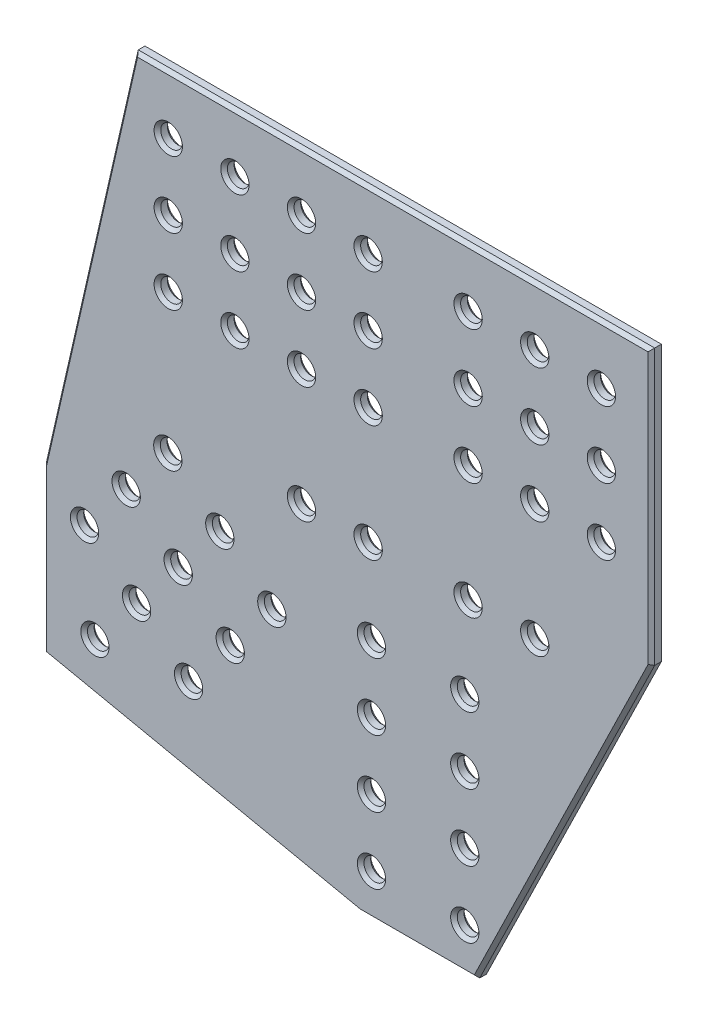
from build123d import *

# Parameters (mm, degrees)
SKETCH_1_R         = 13
EXTRUDE_1495_DEPTH = 16
CHAMFER_2_SIZE     = 4


with BuildPart() as part:
    # 草图1 → Extrude 1495 (new body)
    with BuildSketch(Plane.XY):
        Polygon((730, -330), (520, -760), (380, -760), (0, -680), (0, -482.786642105), (110, 0), (730, 0), align=None)
        with Locations((510, -70)):
            Circle(SKETCH_1_R, mode=Mode.SUBTRACT)
        with Locations((590, -70)):
            Circle(SKETCH_1_R, mode=Mode.SUBTRACT)
        with Locations((670, -70)):
            Circle(SKETCH_1_R, mode=Mode.SUBTRACT)
        with Locations((510, -150)):
            Circle(SKETCH_1_R, mode=Mode.SUBTRACT)
        with Locations((590, -150)):
            Circle(SKETCH_1_R, mode=Mode.SUBTRACT)
        with Locations((670, -150)):
            Circle(SKETCH_1_R, mode=Mode.SUBTRACT)
        with Locations((510, -230)):
            Circle(SKETCH_1_R, mode=Mode.SUBTRACT)
        with Locations((590, -230)):
            Circle(SKETCH_1_R, mode=Mode.SUBTRACT)
        with Locations((670, -230)):
            Circle(SKETCH_1_R, mode=Mode.SUBTRACT)
        with Locations(Location((230, -230, 0), (0, 0, 180))):
            Circle(SKETCH_1_R, mode=Mode.SUBTRACT)
        with Locations(Location((310, -230, 0), (0, 0, 180))):
            Circle(SKETCH_1_R, mode=Mode.SUBTRACT)
        with Locations(Location((390, -230, 0), (0, 0, 180))):
            Circle(SKETCH_1_R, mode=Mode.SUBTRACT)
        with Locations(Location((230, -150, 0), (0, 0, 180))):
            Circle(SKETCH_1_R, mode=Mode.SUBTRACT)
        with Locations(Location((310, -150, 0), (0, 0, 180))):
            Circle(SKETCH_1_R, mode=Mode.SUBTRACT)
        with Locations(Location((390, -150, 0), (0, 0, 180))):
            Circle(SKETCH_1_R, mode=Mode.SUBTRACT)
        with Locations(Location((230, -70, 0), (0, 0, 180))):
            Circle(SKETCH_1_R, mode=Mode.SUBTRACT)
        with Locations(Location((310, -70, 0), (0, 0, 180))):
            Circle(SKETCH_1_R, mode=Mode.SUBTRACT)
        with Locations(Location((390, -70, 0), (0, 0, 180))):
            Circle(SKETCH_1_R, mode=Mode.SUBTRACT)
        with Locations((150, -70)):
            Circle(SKETCH_1_R, mode=Mode.SUBTRACT)
        with Locations((150, -150)):
            Circle(SKETCH_1_R, mode=Mode.SUBTRACT)
        with Locations((150, -230)):
            Circle(SKETCH_1_R, mode=Mode.SUBTRACT)
        with Locations((590, -370)):
            Circle(SKETCH_1_R, mode=Mode.SUBTRACT)
        with Locations((510, -370)):
            Circle(SKETCH_1_R, mode=Mode.SUBTRACT)
        with Locations(Location((390, -370, 0), (0, 0, 180))):
            Circle(SKETCH_1_R, mode=Mode.SUBTRACT)
        with Locations(Location((310, -370, 0), (0, 0, 180))):
            Circle(SKETCH_1_R, mode=Mode.SUBTRACT)
        with Locations((506, -470)):
            Circle(SKETCH_1_R, mode=Mode.SUBTRACT)
        with Locations((506, -550)):
            Circle(SKETCH_1_R, mode=Mode.SUBTRACT)
        with Locations((506, -630)):
            Circle(SKETCH_1_R, mode=Mode.SUBTRACT)
        with Locations((506, -710)):
            Circle(SKETCH_1_R, mode=Mode.SUBTRACT)
        with Locations(Location((394, -710, 0), (0, 0, 180))):
            Circle(SKETCH_1_R, mode=Mode.SUBTRACT)
        with Locations(Location((394, -630, 0), (0, 0, 180))):
            Circle(SKETCH_1_R, mode=Mode.SUBTRACT)
        with Locations(Location((394, -550, 0), (0, 0, 180))):
            Circle(SKETCH_1_R, mode=Mode.SUBTRACT)
        with Locations(Location((394, -470, 0), (0, 0, 180))):
            Circle(SKETCH_1_R, mode=Mode.SUBTRACT)
        with Locations((149.479377198, -397.484050539)):
            Circle(SKETCH_1_R, mode=Mode.SUBTRACT)
        with Locations((99.493096694, -459.945012437)):
            Circle(SKETCH_1_R, mode=Mode.SUBTRACT)
        with Locations((49.506816189, -522.405974336)):
            Circle(SKETCH_1_R, mode=Mode.SUBTRACT)
        with Locations((61.981497584, -634.85321674)):
            Circle(SKETCH_1_R, mode=Mode.SUBTRACT)
        with Locations((111.967778088, -572.392254841)):
            Circle(SKETCH_1_R, mode=Mode.SUBTRACT)
        with Locations((161.954058593, -509.931292942)):
            Circle(SKETCH_1_R, mode=Mode.SUBTRACT)
        with Locations((211.940339097, -447.470331043)):
            Circle(SKETCH_1_R, mode=Mode.SUBTRACT)
        with Locations(Location((174.428739987, -622.378535345, 0), (0, 0, 180))):
            Circle(SKETCH_1_R, mode=Mode.SUBTRACT)
        with Locations(Location((224.415020492, -559.917573446, 0), (0, 0, 180))):
            Circle(SKETCH_1_R, mode=Mode.SUBTRACT)
        with Locations(Location((274.401300996, -497.456611548, 0), (0, 0, 180))):
            Circle(SKETCH_1_R, mode=Mode.SUBTRACT)
    extrude(amount=EXTRUDE_1495_DEPTH)

    # 倒角2
    chamfer_2_edges = [part.edges().sort_by_distance(p)[0] for p in [
        (55, -241.393321053, 16),
        (497, -370, 0),
        (497, -370, 16),
        (403, -370, 0),
        (403, -370, 16),
        (323, -370, 0),
        (323, -370, 16),
        (493, -470, 0),
        (493, -470, 16),
        (493, -550, 0),
        (493, -550, 16),
        (493, -630, 0),
        (493, -630, 16),
        (493, -710, 0),
        (493, -710, 16),
        (407, -710, 0),
        (407, -710, 16),
        (0, -581.393321053, 16),
        (407, -630, 0),
        (407, -630, 16),
        (407, -550, 0),
        (407, -550, 16),
        (136.479377198, -397.484050539, 0),
        (136.479377198, -397.484050539, 16),
        (86.493096694, -459.945012437, 0),
        (86.493096694, -459.945012437, 16),
        (36.506816189, -522.405974336, 0),
        (36.506816189, -522.405974336, 16),
        (48.981497584, -634.85321674, 0),
        (48.981497584, -634.85321674, 16),
        (98.967778088, -572.392254841, 0),
        (98.967778088, -572.392254841, 16),
        (148.954058593, -509.931292942, 0),
        (148.954058593, -509.931292942, 16),
        (190, -720, 16),
        (198.940339097, -447.470331043, 0),
        (198.940339097, -447.470331043, 16),
        (187.428739987, -622.378535345, 0),
        (187.428739987, -622.378535345, 16),
        (237.415020492, -559.917573446, 0),
        (237.415020492, -559.917573446, 16),
        (287.401300996, -497.456611548, 0),
        (287.401300996, -497.456611548, 16),
        (407, -470, 0),
        (407, -470, 16),
        (497, -70, 0),
        (497, -70, 16),
        (450, -760, 16),
        (625, -545, 16),
        (577, -70, 0),
        (577, -70, 16),
        (657, -70, 0),
        (657, -70, 16),
        (497, -150, 0),
        (497, -150, 16),
        (577, -150, 0),
        (577, -150, 16),
        (657, -150, 0),
        (657, -150, 16),
        (730, -165, 16),
        (497, -230, 0),
        (497, -230, 16),
        (577, -230, 0),
        (577, -230, 16),
        (657, -230, 0),
        (657, -230, 16),
        (243, -230, 0),
        (243, -230, 16),
        (323, -230, 0),
        (323, -230, 16),
        (403, -230, 0),
        (403, -230, 16),
        (243, -150, 0),
        (243, -150, 16),
        (323, -150, 0),
        (323, -150, 16),
        (625, -545, 0),
        (420, 0, 16),
        (403, -150, 0),
        (403, -150, 16),
        (450, -760, 0),
        (243, -70, 0),
        (243, -70, 16),
        (190, -720, 0),
        (323, -70, 0),
        (323, -70, 16),
        (0, -581.393321053, 0),
        (403, -70, 0),
        (403, -70, 16),
        (55, -241.393321053, 0),
        (137, -70, 0),
        (137, -70, 16),
        (420, 0, 0),
        (137, -150, 0),
        (137, -150, 16),
        (730, -165, 0),
        (137, -230, 0),
        (137, -230, 16),
        (577, -370, 0),
        (577, -370, 16),
    ]]
    chamfer(chamfer_2_edges, length=CHAMFER_2_SIZE)


solid = part.part
